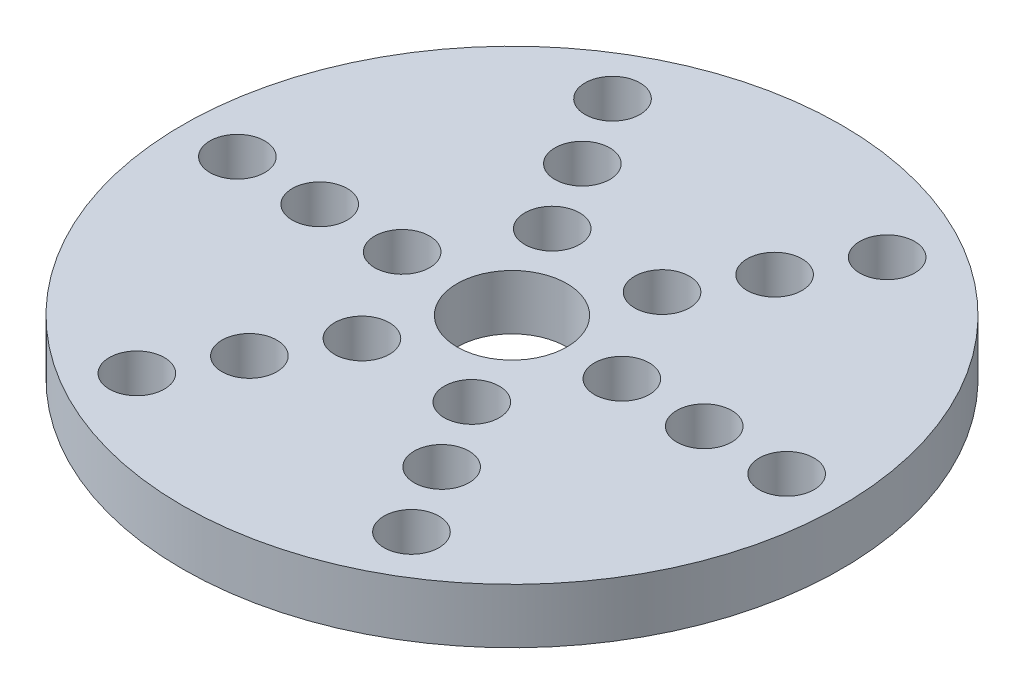
from build123d import *

# Parameters (mm, degrees)
SKETCH1_R           = 5
BOSS_EXTRUDE2_DEPTH = 10


with BuildPart() as part:
    # Sketch1 → Boss-Extrude2 (new body)
    with BuildSketch(Plane(origin=(0, 0, 0), x_dir=(1, 0, 0), z_dir=(0, 1, 0))):
        with BuildLine():
            ThreePointArc((0, 60), (-42.426406871, 42.426406871), (-60, 0))
            ThreePointArc((-60, 0), (-42.426406871, -42.426406871), (0, -60))
            ThreePointArc((0, -60), (42.426406871, -42.426406871), (60, 0))
            ThreePointArc((60, 0), (42.426406871, 42.426406871), (0, 60))
        make_face()
        with Locations(Location((-25, 43.301270189, 0), (0, 0, 270))):
            Circle(SKETCH1_R, mode=Mode.SUBTRACT)
        with Locations(Location((-17.5, 30.310889132, 0), (0, 0, 270))):
            Circle(SKETCH1_R, mode=Mode.SUBTRACT)
        with Locations(Location((-10, 17.320508076, 0), (0, 0, 270))):
            Circle(SKETCH1_R, mode=Mode.SUBTRACT)
        with Locations(Location((25, 43.301270189, 0), (0, 0, 270))):
            Circle(SKETCH1_R, mode=Mode.SUBTRACT)
        with Locations(Location((17.5, 30.310889132, 0), (0, 0, 270))):
            Circle(SKETCH1_R, mode=Mode.SUBTRACT)
        with Locations(Location((10, 17.320508076, 0), (0, 0, 270))):
            Circle(SKETCH1_R, mode=Mode.SUBTRACT)
        with Locations(Location((50, 0, 0), (0, 0, 270))):
            Circle(SKETCH1_R, mode=Mode.SUBTRACT)
        with Locations(Location((35, 0, 0), (0, 0, 270))):
            Circle(SKETCH1_R, mode=Mode.SUBTRACT)
        with Locations(Location((20, 0, 0), (0, 0, 270))):
            Circle(SKETCH1_R, mode=Mode.SUBTRACT)
        with Locations(Location((25, -43.301270189, 0), (0, 0, 270))):
            Circle(SKETCH1_R, mode=Mode.SUBTRACT)
        with Locations(Location((17.5, -30.310889132, 0), (0, 0, 270))):
            Circle(SKETCH1_R, mode=Mode.SUBTRACT)
        with Locations(Location((10, -17.320508076, 0), (0, 0, 270))):
            Circle(SKETCH1_R, mode=Mode.SUBTRACT)
        with Locations(Location((-25, -43.301270189, 0), (0, 0, 270))):
            Circle(SKETCH1_R, mode=Mode.SUBTRACT)
        with Locations(Location((-17.5, -30.310889132, 0), (0, 0, 270))):
            Circle(SKETCH1_R, mode=Mode.SUBTRACT)
        with Locations(Location((-10, -17.320508076, 0), (0, 0, 270))):
            Circle(SKETCH1_R, mode=Mode.SUBTRACT)
        with Locations(Location((-50, 0, 0), (0, 0, 270))):
            Circle(SKETCH1_R, mode=Mode.SUBTRACT)
        with Locations(Location((-35, 0, 0), (0, 0, 270))):
            Circle(SKETCH1_R, mode=Mode.SUBTRACT)
        with Locations(Location((-20, 0, 0), (0, 0, 270))):
            Circle(SKETCH1_R, mode=Mode.SUBTRACT)
        with BuildLine():
            ThreePointArc((0, 10), (-7.071067812, 7.071067812), (-10, 0))
            ThreePointArc((-10, 0), (-7.071067812, -7.071067812), (0, -10))
            ThreePointArc((0, -10), (7.071067812, -7.071067812), (10, 0))
            ThreePointArc((10, 0), (7.071067812, 7.071067812), (0, 10))
        make_face(mode=Mode.SUBTRACT)
    extrude(amount=BOSS_EXTRUDE2_DEPTH)


solid = part.part
